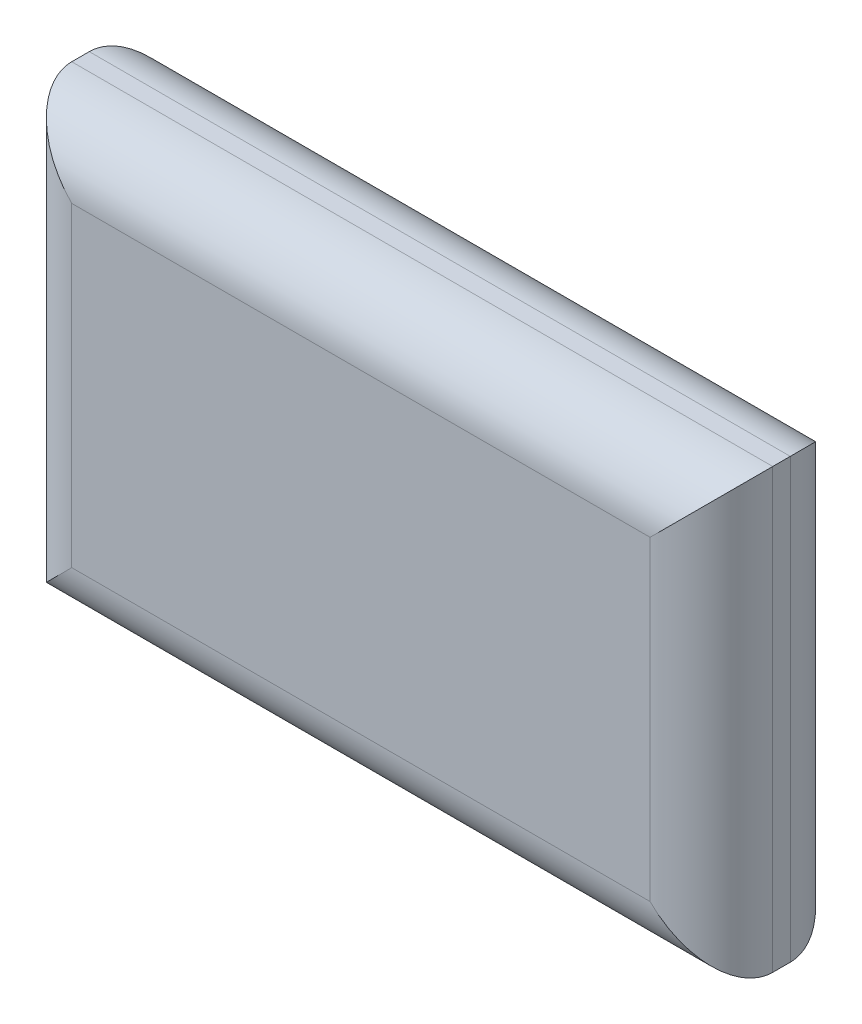
from build123d import *

# Parameters (mm, degrees)
ESBO_O1_W                = 40
ESBO_O1_H                = 25
RESSALTO_EXTRUS_O1_DEPTH = 8
FILETE1_R                = 3.5
ESBO_O2_R                = 0.5
CORTE_EXTRUS_O1_DEPTH    = 2


with BuildPart() as part:
    # Esboço1 → Ressalto-extrusão1 (new body)
    with BuildSketch(Plane.XY):
        Rectangle(ESBO_O1_W, ESBO_O1_H)
    extrude(amount=RESSALTO_EXTRUS_O1_DEPTH)

    # Filete1
    filete1_edges = [part.edges().sort_by_distance(p)[0] for p in [
        (-20, 0, 8),
        (0, -12.5, 8),
        (20, 0, 8),
        (0, -12.5, 0),
        (-20, 0, 0),
        (0, 12.5, 0),
        (20, 0, 0),
        (0, 12.5, 8),
    ]]
    fillet(filete1_edges, radius=FILETE1_R)

    # Esboço2 → Corte-extrusão1 (cut)
    with BuildSketch(Plane.XZ.offset(12.5)):
        with Locations(Location((-19.2, 4.75, 0), (0, 0, 270))):
            Circle(ESBO_O2_R)
        with Locations(Location((-19.2, 3.25, 0), (0, 0, 30))):
            Circle(ESBO_O2_R)
    extrude(amount=-CORTE_EXTRUS_O1_DEPTH, mode=Mode.SUBTRACT)


solid = part.part
